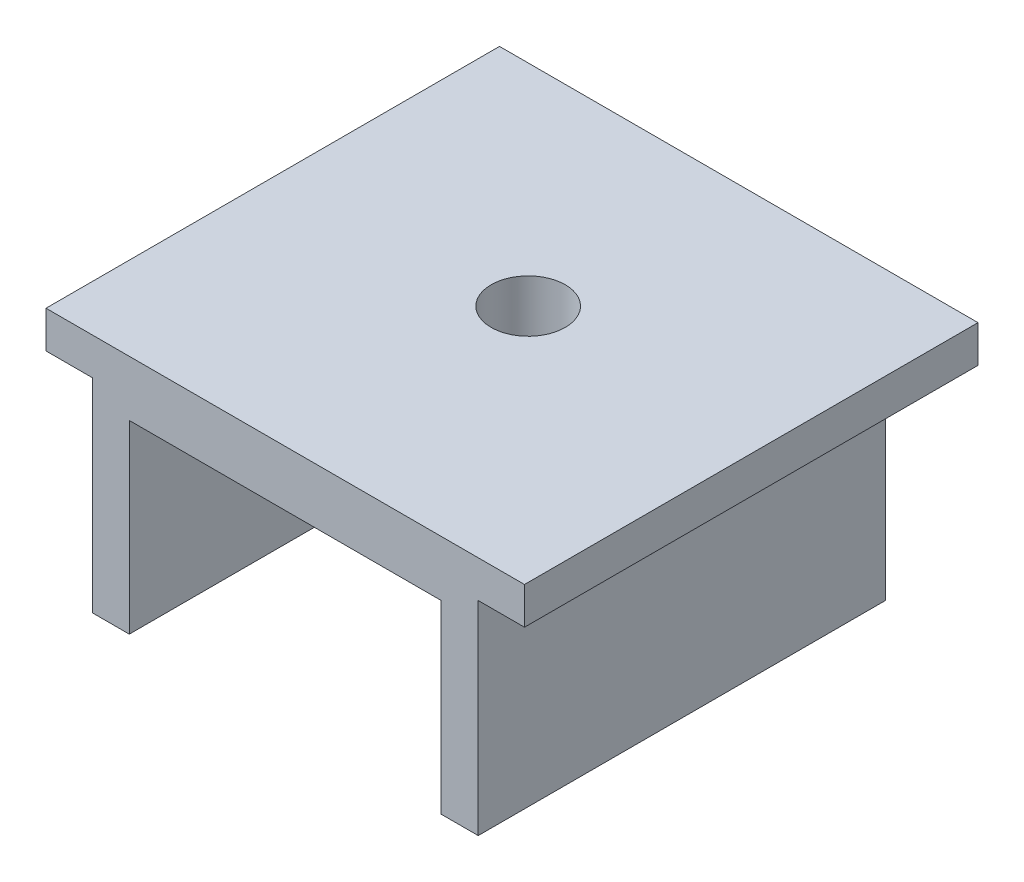
from build123d import *

# Parameters (mm, degrees)
EXTRUDE_1_DEPTH     = 40
SKETCH_1_3_W        = 41.7
SKETCH_1_3_H        = 26
EXTRUDE_2_DEPTH     = 4
SKETCH_2_W          = 51.7
SKETCH_2_H          = 49
EXTRUDE_3_DEPTH     = 4
SKETCH_3_R          = 4
CUT_EXTRUDE_1_DEPTH = 8


with BuildPart() as part:
    # 草图1 → 凸台-拉伸1 (new body)
    with BuildSketch(Plane.XY):
        Polygon((16.85, -13), (20.85, -13), (20.85, 13), (-20.85, 13), (-20.85, -13), (-16.85, -13), (-16.85, 7), (16.85, 7), align=None)
    extrude(amount=EXTRUDE_1_DEPTH)

    # 草图1<3> → 凸台-拉伸2 (add)
    with BuildSketch(Plane.XY):
        Rectangle(SKETCH_1_3_W, SKETCH_1_3_H)
    extrude(amount=-EXTRUDE_2_DEPTH)

    # 草图2 → 凸台-拉伸3 (add)
    with BuildSketch(Plane(origin=(0, 13, 0), x_dir=(1, 0, 0), z_dir=(0, 1, 0))):
        with Locations((0, -15.5)):
            Rectangle(SKETCH_2_W, SKETCH_2_H)
    extrude(amount=-EXTRUDE_3_DEPTH)

    # 草图3 → 切除-拉伸1 (cut)
    with BuildSketch(Plane.XZ.offset(-7)):
        with Locations((0, 13.75)):
            Circle(SKETCH_3_R)
    extrude(amount=-CUT_EXTRUDE_1_DEPTH, mode=Mode.SUBTRACT)


solid = part.part
